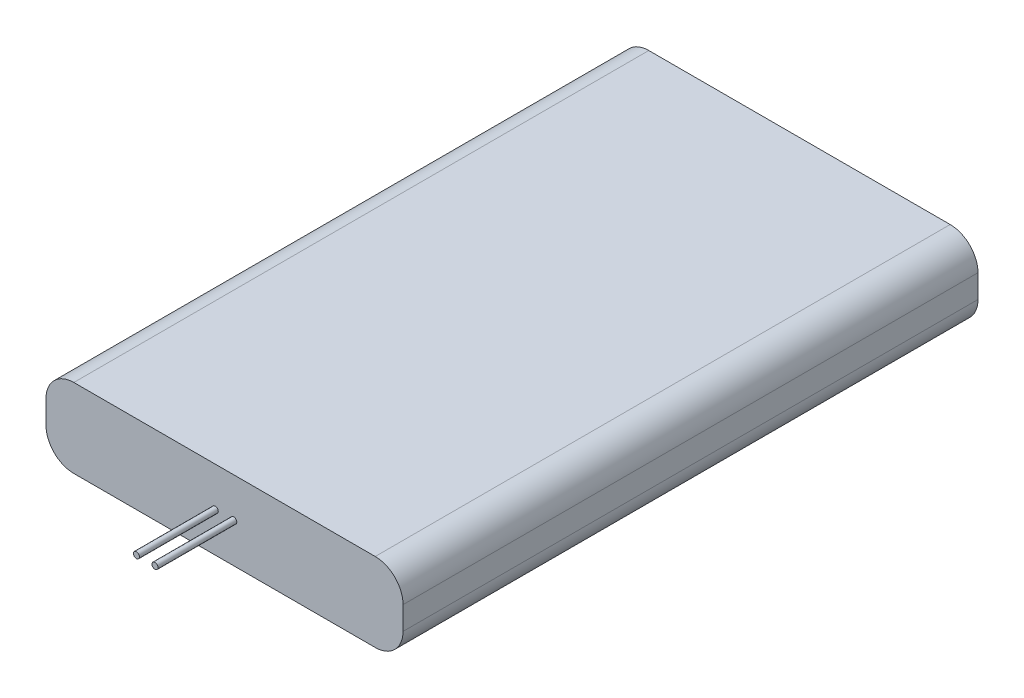
from build123d import *

# Parameters (mm, degrees)
SKETCH1_W           = 38.5
SKETCH1_H           = 62
BOSS_EXTRUDE1_DEPTH = 8.5
FILLET1_R           = 3
SKETCH2_R           = 0.325
BOSS_EXTRUDE2_DEPTH = 8.5


with BuildPart() as part:
    # Sketch1 → Boss-Extrude1 (new body)
    with BuildSketch(Plane(origin=(0, 0, 0), x_dir=(1, 0, 0), z_dir=(0, 1, 0))):
        Rectangle(SKETCH1_W, SKETCH1_H)
    extrude(amount=BOSS_EXTRUDE1_DEPTH)

    # Fillet1
    fillet1_edges = [part.edges().sort_by_distance(p)[0] for p in [
        (-19.25, 8.5, 0),
        (19.25, 8.5, 0),
        (-19.25, 0, 0),
        (19.25, 0, 0),
    ]]
    fillet(fillet1_edges, radius=FILLET1_R)

    # Sketch2 → Boss-Extrude2 (add)
    with BuildSketch(Plane.XY.offset(31)):
        with Locations(Location((-1, 4.25, 0), (0, 0, 180))):
            Circle(SKETCH2_R)
        with Locations(Location((1, 4.25, 0), (0, 0, 180))):
            Circle(SKETCH2_R)
    extrude(amount=BOSS_EXTRUDE2_DEPTH)


solid = part.part
